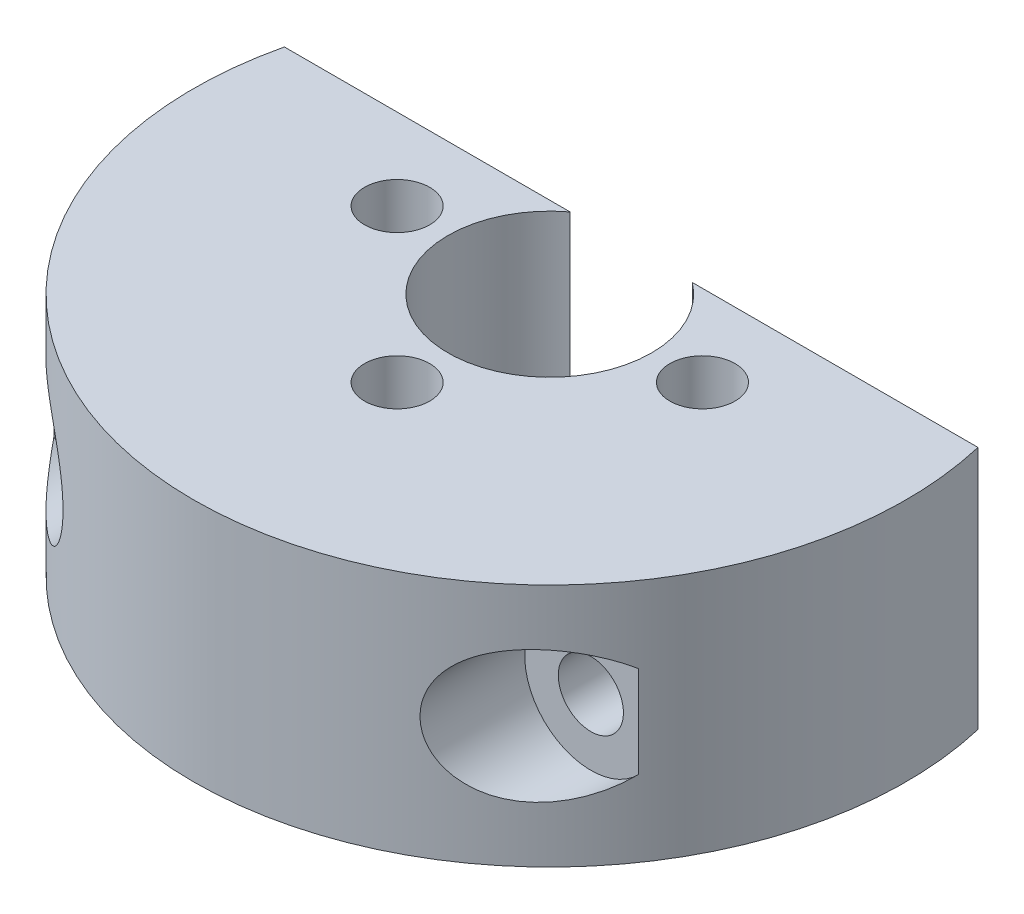
from build123d import *

# Parameters (mm, degrees)
SKETCH1_R               = 17.5
SKETCH1_R_2             = 5
BOSS_EXTRUDE1_DEPTH     = 12
CUT_EXTRUDE1_REACH      = 32.208
SKETCH2_W               = 40
SKETCH2_H               = 15
CUT_EXTRUDE2_REACH      = 32.208
CUT_EXTRUDE2_END_RADIUS = 17.5
SKETCH3_R               = 1.6
SKETCH5_R               = 3.25
CUT_EXTRUDE3_DEPTH      = 7.5
SKETCH8_R               = 1.6
CUT_EXTRUDE4_DEPTH      = 28.50454525


with BuildPart() as part:
    # Sketch1 → Boss-Extrude1 (new body)
    with BuildSketch(Plane(origin=(0, 0, 0), x_dir=(1, 0, 0), z_dir=(0, 1, 0))):
        with Locations(Location((0, 0, 0), (0, 0, 270))):
            Circle(SKETCH1_R)
        with Locations(Location((0, 0, 0), (0, 0, 270))):
            Circle(SKETCH1_R_2, mode=Mode.SUBTRACT)
    extrude(amount=BOSS_EXTRUDE1_DEPTH)

    # Sketch2 → Cut-Extrude1 (cut, up to next)
    with BuildSketch(Plane.XY.offset(-4), mode=Mode.PRIVATE) as cut_extrude1_sk1:
        with Locations((-0.027437806, 7.5)):
            Rectangle(SKETCH2_W, SKETCH2_H)
    cut_extrude1_tool1 = extrude(cut_extrude1_sk1.sketch, amount=-CUT_EXTRUDE1_REACH, mode=Mode.PRIVATE) & part.part
    add(cut_extrude1_tool1.solids().sort_by_distance((-0.027438, 7.5, -4))[0], mode=Mode.SUBTRACT)

    # Cut-Extrude2: up to this cylinder (the profile starts inside it)
    cut_extrude2_end = Plane(origin=(0, 6, 0), z_dir=(0, -1, 0)) * Cylinder(CUT_EXTRUDE2_END_RADIUS, 100.416, mode=Mode.PRIVATE)
    # Sketch3 → Cut-Extrude2 (cut, up to the surface)
    with BuildSketch(Plane(origin=(0, 0, -4), x_dir=(-1, 0, 0), z_dir=(0, 0, -1)), mode=Mode.PRIVATE) as cut_extrude2_sk1:
        with Locations((-12.018362519, 6)):
            Circle(SKETCH3_R)
    cut_extrude2_tool1 = extrude(cut_extrude2_sk1.sketch, amount=-CUT_EXTRUDE2_REACH, mode=Mode.PRIVATE) & cut_extrude2_end
    add(cut_extrude2_tool1.solids().sort_by_distance((12.018363, 6, -4))[0], mode=Mode.SUBTRACT)
    # Sketch3 → Cut-Extrude2 (cut, up to the surface)
    with BuildSketch(Plane(origin=(0, 0, -4), x_dir=(-1, 0, 0), z_dir=(0, 0, -1)), mode=Mode.PRIVATE) as cut_extrude2_sk2:
        with Locations((12.018362519, 6)):
            Circle(SKETCH3_R)
    cut_extrude2_tool2 = extrude(cut_extrude2_sk2.sketch, amount=-CUT_EXTRUDE2_REACH, mode=Mode.PRIVATE) & cut_extrude2_end
    add(cut_extrude2_tool2.solids().sort_by_distance((-12.018363, 6, -4))[0], mode=Mode.SUBTRACT)

    # Sketch5 → Cut-Extrude3 (cut)
    with BuildSketch(Plane.XY.offset(17.5)):
        with Locations((-12.018362519, 6)):
            Circle(SKETCH5_R)
        with Locations((12.018362519, 6)):
            Circle(SKETCH5_R)
    extrude(amount=-CUT_EXTRUDE3_DEPTH, mode=Mode.SUBTRACT)

    # Sketch8 → Cut-Extrude4 (cut, through all)
    with BuildSketch(Plane(origin=(0, 12, 0), x_dir=(1, 0, 0), z_dir=(0, 1, 0))):
        with Locations(Location((-7.5, 0, 0), (0, 0, 270))):
            Circle(SKETCH8_R)
        with Locations(Location((7.5, 0, 0), (0, 0, 270))):
            Circle(SKETCH8_R)
        with Locations(Location((0, -7.5, 0), (0, 0, 270))):
            Circle(SKETCH8_R)
    extrude(amount=-CUT_EXTRUDE4_DEPTH, mode=Mode.SUBTRACT)


solid = part.part
